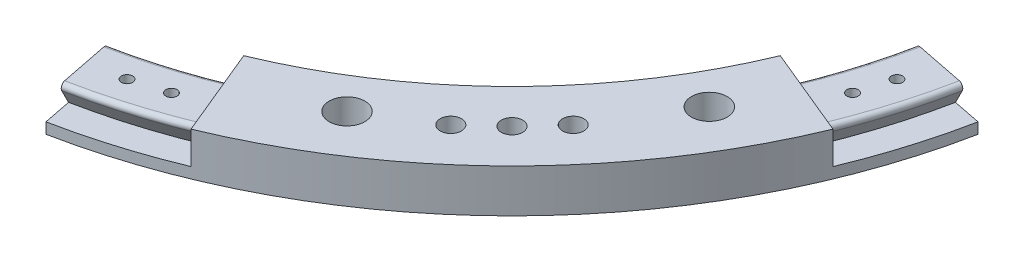
from build123d import *

# Parameters (mm, degrees)
SKETCH1_W                = 28.575
SKETCH1_H                = 12.7
CUT_EXTRUDE1_DEPTH       = 9.525
F_12_CLEARANCE_HOLE1_D   = 6.2484
M4X0_7_TAPPED_HOLE1_D    = 3.3
CIRPATTERN1_COUNT        = 4
Z_0_413_DIAMETER_HOLE1_D = 10.4902
FILLET1_R                = 1.27
CUT_EXTRUDE2_DEPTH       = 247.298196718
CUT_EXTRUDE2_DEPTH_BACK  = 247.298196718


with BuildPart() as part:
    # Sketch1 → Revolve1 (revolve)
    with BuildSketch(Plane.XY, mode=Mode.PRIVATE) as revolve1_sk:
        with Locations((159.813733777, 1058.545)):
            Rectangle(SKETCH1_W, SKETCH1_H)
    revolve(revolve1_sk.sketch.rotate(Axis((0, 1125.81516809, 0), (0, -1, 0)), 180), axis=Axis((0, 1125.81516809, 0), (0, -1, 0)))

    # Sketch19 → Cut-Extrude1 (cut)
    with BuildSketch(Plane(origin=(0, 1064.895, 0), x_dir=(1, 0, 0), z_dir=(0, 1, 0))):
        with BuildLine():
            Line((160.848566471, -66.625657721), (134.44870883, -55.690478641))
            ThreePointArc((134.44870883, -55.690478641), (145.526233777, 0), (134.44870883, 55.690478641))
            Line((134.44870883, 55.690478641), (160.848566471, 66.625657721))
            ThreePointArc((160.848566471, 66.625657721), (174.101233777, 0), (160.848566471, -66.625657721))
        make_face()
        with BuildLine():
            Line((-66.625657721, 160.848566471), (-55.690478641, 134.44870883))
            ThreePointArc((-55.690478641, 134.44870883), (0, 145.526233777), (55.690478641, 134.44870883))
            Line((55.690478641, 134.44870883), (66.625657721, 160.848566471))
            ThreePointArc((66.625657721, 160.848566471), (0, 174.101233777), (-66.625657721, 160.848566471))
        make_face()
        with BuildLine():
            Line((-134.44870883, -55.690478641), (-160.848566471, -66.625657721))
            ThreePointArc((-160.848566471, -66.625657721), (-174.101233777, 0), (-160.848566471, 66.625657721))
            Line((-160.848566471, 66.625657721), (-134.44870883, 55.690478641))
            ThreePointArc((-134.44870883, 55.690478641), (-145.526233777, 0), (-134.44870883, -55.690478641))
        make_face()
        with BuildLine():
            Line((-55.690478641, -134.44870883), (-66.625657721, -160.848566471))
            ThreePointArc((-66.625657721, -160.848566471), (0, -174.101233777), (66.625657721, -160.848566471))
            Line((66.625657721, -160.848566471), (55.690478641, -134.44870883))
            ThreePointArc((55.690478641, -134.44870883), (0, -145.526233777), (-55.690478641, -134.44870883))
        make_face()
    extrude(amount=-CUT_EXTRUDE1_DEPTH, mode=Mode.SUBTRACT)

    # Sketch21 → Revolve2 (revolve)
    with BuildSketch(Plane.XY):
        Polygon((-165.672559567, 1055.37), (-153.954907986, 1055.37), (-150.288733777, 1061.72), (-169.338733777, 1061.72), align=None)
    revolve(axis=Axis((0, 0, 0), (0, 1, 0)))

    # #12 Clearance Hole1 (through all)
    with Locations(Plane(origin=(0, 1052.195, 0), x_dir=(-1, 0, 0), z_dir=(0, -1, 0))):
        with Locations((103.667734326, 121.628246568), (121.628246568, 103.667734326), (113.00537488, 113.00537488)):
            f_12_clearance_hole1 = Hole(F_12_CLEARANCE_HOLE1_D / 2)

    # M4x0.7 Tapped Hole1 (through all)
    with Locations(Plane(origin=(0, 1061.72, 0), x_dir=(1, 0, 0), z_dir=(0, 1, 0))):
        with Locations((-51.370441133, 151.33243962), (-41.36283797, 154.36821285), (51.370441133, 151.33243962), (41.36283797, 154.36821285)):
            m4x0_7_tapped_hole1 = Hole(M4X0_7_TAPPED_HOLE1_D / 2)

    # CirPattern1: #12 Clearance Hole1, M4x0.7 Tapped Hole1 ×4 about axis
    cirpattern1_axis = Axis((0, 0, 0), (0, 1, 0))
    add([f_12_clearance_hole1.rotate(cirpattern1_axis, i * 360 / CIRPATTERN1_COUNT) for i in range(1, CIRPATTERN1_COUNT)], mode=Mode.SUBTRACT)
    add([m4x0_7_tapped_hole1.rotate(cirpattern1_axis, i * 360 / CIRPATTERN1_COUNT) for i in range(1, CIRPATTERN1_COUNT)], mode=Mode.SUBTRACT)

    # Z (0.413) Diameter Hole1 (through all)
    with Locations(Plane(origin=(0, 1064.895, 0), x_dir=(1, 0, 0), z_dir=(0, 1, 0))):
        with Locations((-137.027937996, -79.113116888), (137.027937996, -79.113116888), (137.027937996, 79.113116888), (-137.027937996, 79.113116888), (-85.014893438, 133.44665207), (85.014893438, 133.44665207), (85.014893438, -133.44665207), (-85.014893438, -133.44665207)):
            Hole(Z_0_413_DIAMETER_HOLE1_D / 2)

    # Fillet1
    fillet1_edges = [part.edges().sort_by_distance(p)[0] for p in [
        (-150.288733777, 1061.72, 0),
        (0, 1061.72, 150.288733777),
        (0, 1061.72, -150.288733777),
        (150.288733777, 1061.72, 0),
        (-169.338733777, 1061.72, 0),
        (0, 1061.72, 169.338733777),
        (0, 1061.72, -169.338733777),
        (169.338733777, 1061.72, 0),
    ]]
    fillet(fillet1_edges, radius=FILLET1_R)

    # Sketch23 → Cut-Extrude2 (cut, two sides: drawn at the far end of the back side and taken through both)
    with BuildSketch(Plane(origin=(0, 1058.545, 0), x_dir=(1, 0, 0), z_dir=(0, 1, 0)).offset(-CUT_EXTRUDE2_DEPTH_BACK)):
        with BuildLine():
            ThreePointArc((174.101233777, 0), (173.262888749, 17.064905063), (170.755927388, 33.965465761))
            Line((170.755927388, 33.965465761), (142.729988001, 28.390759809))
            ThreePointArc((142.729988001, 28.390759809), (144.825485185, 14.264065278), (145.526233777, 0))
            ThreePointArc((145.526233777, 0), (144.825485185, -14.264065278), (142.729988001, -28.390759809))
            Line((142.729988001, -28.390759809), (170.755927388, -33.965465761))
            ThreePointArc((170.755927388, -33.965465761), (173.262888749, -17.064905063), (174.101233777, 0))
        make_face()
        with BuildLine():
            Line((-142.729988001, 28.390759809), (-170.755927388, 33.965465761))
            ThreePointArc((-170.755927388, 33.965465761), (-174.101233777, 0), (-170.755927388, -33.965465761))
            Line((-170.755927388, -33.965465761), (-142.729988001, -28.390759809))
            ThreePointArc((-142.729988001, -28.390759809), (-145.526233777, 0), (-142.729988001, 28.390759809))
        make_face()
        with BuildLine():
            Line((28.390759809, 142.729988001), (33.965465761, 170.755927388))
            ThreePointArc((33.965465761, 170.755927388), (0, 174.101233777), (-33.965465761, 170.755927388))
            Line((-33.965465761, 170.755927388), (-28.390759809, 142.729988001))
            ThreePointArc((-28.390759809, 142.729988001), (0, 145.526233777), (28.390759809, 142.729988001))
        make_face()
        with BuildLine():
            ThreePointArc((28.390759809, -142.729988001), (0, -145.526233777), (-28.390759809, -142.729988001))
            Line((-28.390759809, -142.729988001), (-33.965465761, -170.755927388))
            ThreePointArc((-33.965465761, -170.755927388), (0, -174.101233777), (33.965465761, -170.755927388))
            Line((33.965465761, -170.755927388), (28.390759809, -142.729988001))
        make_face()
    extrude(amount=CUT_EXTRUDE2_DEPTH + CUT_EXTRUDE2_DEPTH_BACK, mode=Mode.SUBTRACT)


with BuildPart() as cut_extrude2_kept_piece:
    # of the separate pieces the step leaves, the one the design keeps (cut_extrude2_pieces_kept)
    add(part.part.solids().sort_by_distance((32.321112995, 1055.37, 162.48920779))[0])


solid = cut_extrude2_kept_piece.part
